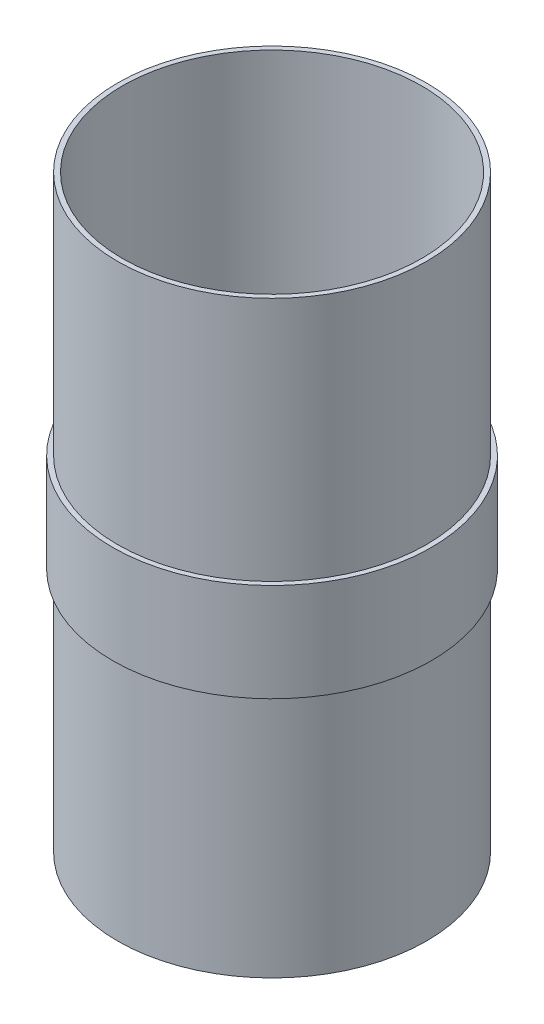
from build123d import *

# Parameters (mm, degrees)
ESBO_O1_R                = 31.5
ESBO_O1_R_2              = 30.5
RESSALTO_EXTRUS_O1_DEPTH = 50
ESBO_O2_R                = 32.5
ESBO_O2_R_2              = 30.5
RESSALTO_EXTRUS_O2_DEPTH = 20
ESBO_O3_R                = 31.5
ESBO_O3_R_2              = 30.5
RESSALTO_EXTRUS_O3_DEPTH = 50
RESSALTO_EXTRUS_O4_START = -5
ESBO_O6_R                = 30.5
RESSALTO_EXTRUS_O4_DEPTH = 5


with BuildPart() as part:
    # Esboço1 → Ressalto-extrusão1 (new body)
    with BuildSketch(Plane(origin=(0, 0, 0), x_dir=(1, 0, 0), z_dir=(0, 1, 0))):
        with Locations(Location((0, 0, 0), (0, 0, 270))):
            Circle(ESBO_O1_R)
        with Locations(Location((0, 0, 0), (0, 0, 270))):
            Circle(ESBO_O1_R_2, mode=Mode.SUBTRACT)
    extrude(amount=RESSALTO_EXTRUS_O1_DEPTH)


with BuildPart() as body_2:
    # Esboço2 → Ressalto-extrusão2 (new body)
    with BuildSketch(Plane(origin=(0, 50, 0), x_dir=(1, 0, 0), z_dir=(0, 1, 0))):
        with Locations(Location((0, 0, 0), (0, 0, 270))):
            Circle(ESBO_O2_R)
        with Locations(Location((0, 0, 0), (0, 0, 270))):
            Circle(ESBO_O2_R_2, mode=Mode.SUBTRACT)
    extrude(amount=RESSALTO_EXTRUS_O2_DEPTH)



with BuildPart() as body_3:
    # Esboço3 → Ressalto-extrusão3 (new body)
    with BuildSketch(Plane(origin=(0, 70, 0), x_dir=(1, 0, 0), z_dir=(0, 1, 0))):
        with Locations(Location((0, 0, 0), (0, 0, 270))):
            Circle(ESBO_O3_R)
        with Locations(Location((0, 0, 0), (0, 0, 270))):
            Circle(ESBO_O3_R_2, mode=Mode.SUBTRACT)
    extrude(amount=RESSALTO_EXTRUS_O3_DEPTH)


with BuildPart() as body_2_1:
    add(body_2.part)

    add(body_3.part)  # Ressalto-extrusão4 merges body 3
    # Esboço6 → Ressalto-extrusão4 (add)
    with BuildSketch(Plane(origin=(0, 70, 0), x_dir=(1, 0, 0), z_dir=(0, 1, 0)).offset(RESSALTO_EXTRUS_O4_START)):
        with Locations(Location((0, 0, 0), (0, 0, 270))):
            Circle(ESBO_O6_R)
    extrude(amount=RESSALTO_EXTRUS_O4_DEPTH)


with BuildPart() as part_1:
    add(part.part)

    # Combinar3: union body 2
    add(body_2_1.part)


solid = part_1.part
